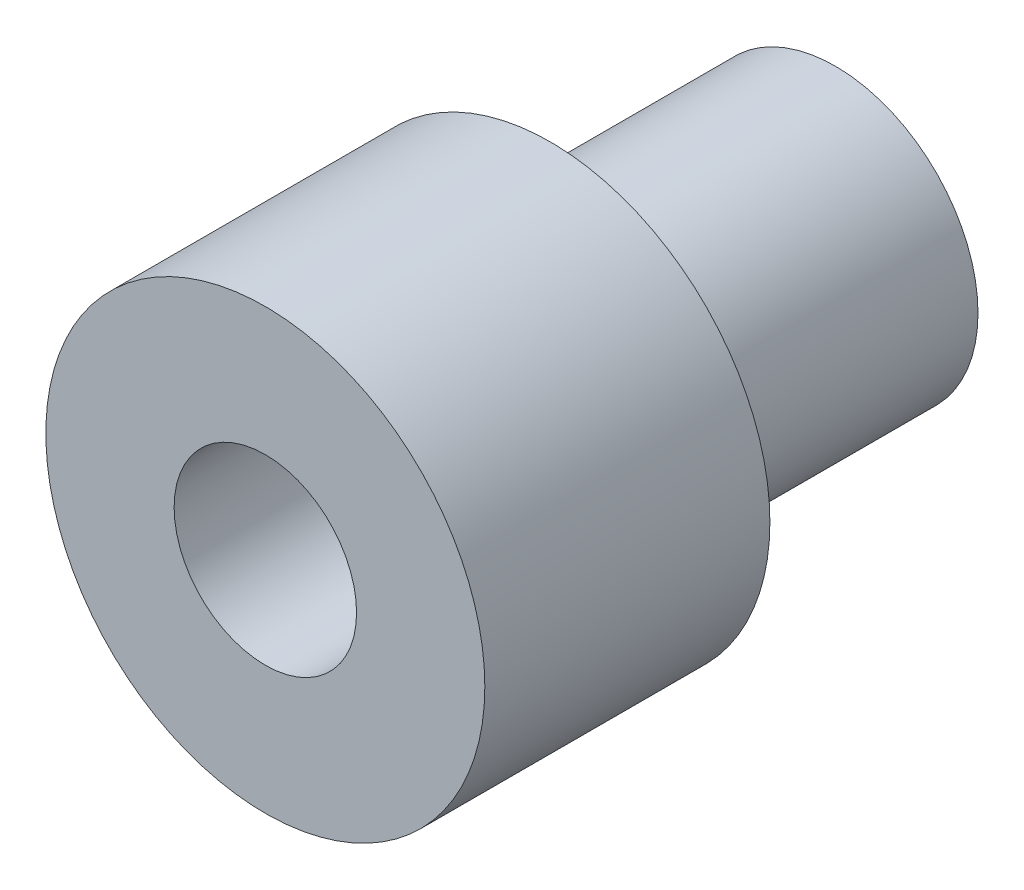
from build123d import *


with BuildPart() as part:
    # Sketch1 → Revolve1 (revolve)
    with BuildSketch(Plane(origin=(0, 0, 0), x_dir=(0, 0, -1), z_dir=(1, 0, 0)), mode=Mode.PRIVATE) as revolve1_sk:
        Polygon((0, 1.6), (0, 3.85), (5, 3.85), (5, 2.5), (10, 2.5), (10, 1.6), align=None)
    revolve(revolve1_sk.sketch.rotate(Axis((0, 0, 0), (0, 0, -1)), 90), axis=Axis((0, 0, 0), (0, 0, -1)))


solid = part.part
